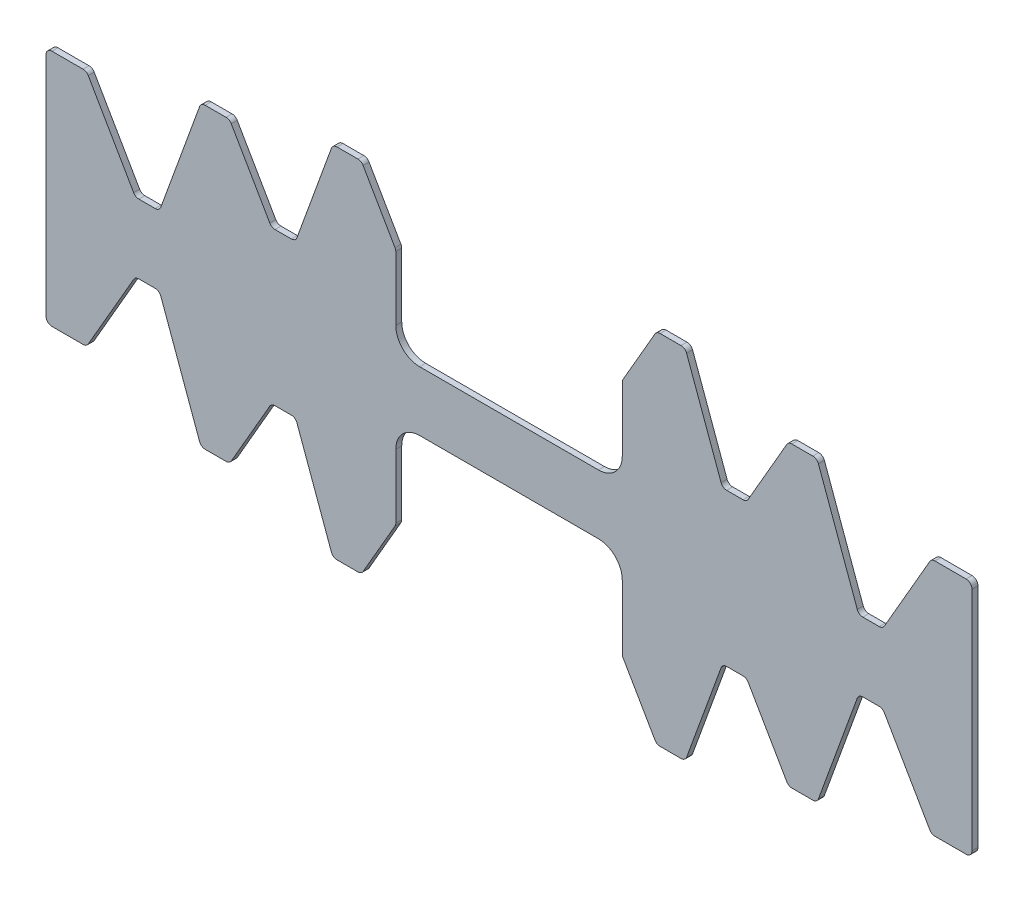
from build123d import *

# Parameters (mm, degrees)
BOSS_EXTRUDE1_DEPTH = 0.5


with BuildPart() as part:
    # Model → Boss-Extrude1 (new body)
    with BuildSketch(Plane.XY):
        with BuildLine():
            Line((1535.049130397, 341.272822748), (1533.294327078, 341.272822748))
            ThreePointArc((1533.294327078, 341.272822748), (1533.044327078, 341.339810046), (1532.861314376, 341.522822748))
            Line((1532.861314376, 341.522822748), (1530.185887896, 346.156797344))
            ThreePointArc((1530.185887896, 346.156797344), (1530.135937685, 346.277387821), (1530.118900598, 346.406797344))
            Line((1530.118900598, 346.406797344), (1530.118900598, 351.772822748))
            ThreePointArc((1530.118900598, 351.772822748), (1529.53311416, 353.18703631), (1528.118900598, 353.772822748))
            Line((1528.118900598, 353.772822748), (1513.118900598, 353.772822748))
            ThreePointArc((1513.118900598, 353.772822748), (1511.704687035, 353.18703631), (1511.118900598, 351.772822748))
            Line((1511.118900598, 351.772822748), (1511.118900598, 346.406797344))
            ThreePointArc((1511.118900598, 346.406797344), (1511.101863511, 346.277387821), (1511.0519133, 346.156797344))
            Line((1511.0519133, 346.156797344), (1508.376486819, 341.522822748))
            ThreePointArc((1508.376486819, 341.522822748), (1508.193474117, 341.339810046), (1507.943474117, 341.272822748))
            Line((1507.943474117, 341.272822748), (1506.188670798, 341.272822748))
            ThreePointArc((1506.188670798, 341.272822748), (1505.90188258, 341.363246725), (1505.718824488, 341.601812676))
            Line((1505.718824488, 341.601812676), (1502.828165556, 349.543832819))
            ThreePointArc((1502.828165556, 349.543832819), (1502.645107463, 349.78239877), (1502.358319245, 349.872822748))
            Line((1502.358319245, 349.872822748), (1500.984812422, 349.872822748))
            ThreePointArc((1500.984812422, 349.872822748), (1500.734812422, 349.805835449), (1500.55179972, 349.622822748))
            Line((1500.55179972, 349.622822748), (1497.318638213, 344.022822748))
            ThreePointArc((1497.318638213, 344.022822748), (1497.135625511, 343.839810046), (1496.885625511, 343.772822748))
            Line((1496.885625511, 343.772822748), (1495.130822192, 343.772822748))
            ThreePointArc((1495.130822192, 343.772822748), (1494.844033974, 343.863246725), (1494.660975881, 344.101812676))
            Line((1494.660975881, 344.101812676), (1491.406346715, 353.043832819))
            ThreePointArc((1491.406346715, 353.043832819), (1491.223288623, 353.28239877), (1490.936500405, 353.372822748))
            Line((1490.936500405, 353.372822748), (1489.562993581, 353.372822748))
            ThreePointArc((1489.562993581, 353.372822748), (1489.312993581, 353.305835449), (1489.129980879, 353.122822748))
            Line((1489.129980879, 353.122822748), (1485.319469103, 346.522822748))
            ThreePointArc((1485.319469103, 346.522822748), (1485.136456401, 346.339810046), (1484.886456401, 346.272822748))
            Line((1484.886456401, 346.272822748), (1482.275131536, 346.272822748))
            ThreePointArc((1482.275131536, 346.272822748), (1481.921578145, 346.419269357), (1481.775131536, 346.772822748))
            Line((1481.775131536, 346.772822748), (1481.775131536, 365.772822748))
            ThreePointArc((1481.775131536, 365.772822748), (1481.921578145, 366.126376138), (1482.275131536, 366.272822748))
            Line((1482.275131536, 366.272822748), (1484.886456401, 366.272822748))
            ThreePointArc((1484.886456401, 366.272822748), (1485.136456401, 366.205835449), (1485.319469103, 366.022822748))
            Line((1485.319469103, 366.022822748), (1489.129980879, 359.422822748))
            ThreePointArc((1489.129980879, 359.422822748), (1489.312993581, 359.239810046), (1489.562993581, 359.172822748))
            Line((1489.562993581, 359.172822748), (1490.936500405, 359.172822748))
            ThreePointArc((1490.936500405, 359.172822748), (1491.223288623, 359.263246725), (1491.406346715, 359.501812676))
            Line((1491.406346715, 359.501812676), (1494.660975881, 368.443832819))
            ThreePointArc((1494.660975881, 368.443832819), (1494.844033974, 368.68239877), (1495.130822192, 368.772822748))
            Line((1495.130822192, 368.772822748), (1496.885625511, 368.772822748))
            ThreePointArc((1496.885625511, 368.772822748), (1497.135625511, 368.705835449), (1497.318638213, 368.522822748))
            Line((1497.318638213, 368.522822748), (1500.55179972, 362.922822748))
            ThreePointArc((1500.55179972, 362.922822748), (1500.734812422, 362.739810046), (1500.984812422, 362.672822748))
            Line((1500.984812422, 362.672822748), (1502.358319245, 362.672822748))
            ThreePointArc((1502.358319245, 362.672822748), (1502.645107463, 362.763246725), (1502.828165556, 363.001812676))
            Line((1502.828165556, 363.001812676), (1505.718824488, 370.943832819))
            ThreePointArc((1505.718824488, 370.943832819), (1505.90188258, 371.18239877), (1506.188670798, 371.272822748))
            Line((1506.188670798, 371.272822748), (1507.943474117, 371.272822748))
            ThreePointArc((1507.943474117, 371.272822748), (1508.193474117, 371.205835449), (1508.376486819, 371.022822748))
            Line((1508.376486819, 371.022822748), (1511.0519133, 366.388848151))
            ThreePointArc((1511.0519133, 366.388848151), (1511.101863511, 366.268257674), (1511.118900598, 366.138848151))
            Line((1511.118900598, 366.138848151), (1511.118900598, 360.772822748))
            ThreePointArc((1511.118900598, 360.772822748), (1511.704687035, 359.358609185), (1513.118900598, 358.772822748))
            Line((1513.118900598, 358.772822748), (1528.118900598, 358.772822748))
            ThreePointArc((1528.118900598, 358.772822748), (1529.53311416, 359.358609185), (1530.118900598, 360.772822748))
            Line((1530.118900598, 360.772822748), (1530.118900598, 366.138848151))
            ThreePointArc((1530.118900598, 366.138848151), (1530.135937685, 366.268257674), (1530.185887896, 366.388848151))
            Line((1530.185887896, 366.388848151), (1532.861314376, 371.022822748))
            ThreePointArc((1532.861314376, 371.022822748), (1533.044327078, 371.205835449), (1533.294327078, 371.272822748))
            Line((1533.294327078, 371.272822748), (1535.049130397, 371.272822748))
            ThreePointArc((1535.049130397, 371.272822748), (1535.335918615, 371.18239877), (1535.518976708, 370.943832819))
            Line((1535.518976708, 370.943832819), (1538.40963564, 363.001812676))
            ThreePointArc((1538.40963564, 363.001812676), (1538.592693732, 362.763246725), (1538.87948195, 362.672822748))
            Line((1538.87948195, 362.672822748), (1540.252988773, 362.672822748))
            ThreePointArc((1540.252988773, 362.672822748), (1540.502988773, 362.739810046), (1540.686001475, 362.922822748))
            Line((1540.686001475, 362.922822748), (1543.919162983, 368.522822748))
            ThreePointArc((1543.919162983, 368.522822748), (1544.102175685, 368.705835449), (1544.352175685, 368.772822748))
            Line((1544.352175685, 368.772822748), (1546.106979004, 368.772822748))
            ThreePointArc((1546.106979004, 368.772822748), (1546.393767222, 368.68239877), (1546.576825314, 368.443832819))
            Line((1546.576825314, 368.443832819), (1549.831454481, 359.501812676))
            ThreePointArc((1549.831454481, 359.501812676), (1550.014512573, 359.263246725), (1550.301300791, 359.172822748))
            Line((1550.301300791, 359.172822748), (1551.674807614, 359.172822748))
            ThreePointArc((1551.674807614, 359.172822748), (1551.924807614, 359.239810046), (1552.107820316, 359.422822748))
            Line((1552.107820316, 359.422822748), (1555.918332093, 366.022822748))
            ThreePointArc((1555.918332093, 366.022822748), (1556.101344795, 366.205835449), (1556.351344795, 366.272822748))
            Line((1556.351344795, 366.272822748), (1558.96266966, 366.272822748))
            ThreePointArc((1558.96266966, 366.272822748), (1559.316223051, 366.126376138), (1559.46266966, 365.772822748))
            Line((1559.46266966, 365.772822748), (1559.46266966, 346.772822748))
            ThreePointArc((1559.46266966, 346.772822748), (1559.316223051, 346.419269357), (1558.96266966, 346.272822748))
            Line((1558.96266966, 346.272822748), (1556.351344795, 346.272822748))
            ThreePointArc((1556.351344795, 346.272822748), (1556.101344795, 346.339810046), (1555.918332093, 346.522822748))
            Line((1555.918332093, 346.522822748), (1552.107820316, 353.122822748))
            ThreePointArc((1552.107820316, 353.122822748), (1551.924807614, 353.305835449), (1551.674807614, 353.372822748))
            Line((1551.674807614, 353.372822748), (1550.301300791, 353.372822748))
            ThreePointArc((1550.301300791, 353.372822748), (1550.014512573, 353.28239877), (1549.831454481, 353.043832819))
            Line((1549.831454481, 353.043832819), (1546.576825314, 344.101812676))
            ThreePointArc((1546.576825314, 344.101812676), (1546.393767222, 343.863246725), (1546.106979004, 343.772822748))
            Line((1546.106979004, 343.772822748), (1544.352175685, 343.772822748))
            ThreePointArc((1544.352175685, 343.772822748), (1544.102175685, 343.839810046), (1543.919162983, 344.022822748))
            Line((1543.919162983, 344.022822748), (1540.686001475, 349.622822748))
            ThreePointArc((1540.686001475, 349.622822748), (1540.502988773, 349.805835449), (1540.252988773, 349.872822748))
            Line((1540.252988773, 349.872822748), (1538.87948195, 349.872822748))
            ThreePointArc((1538.87948195, 349.872822748), (1538.592693732, 349.78239877), (1538.40963564, 349.543832819))
            Line((1538.40963564, 349.543832819), (1535.518976708, 341.601812676))
            ThreePointArc((1535.518976708, 341.601812676), (1535.335918616, 341.363246725), (1535.049130397, 341.272822748))
        make_face()
    extrude(amount=BOSS_EXTRUDE1_DEPTH)


solid = part.part
